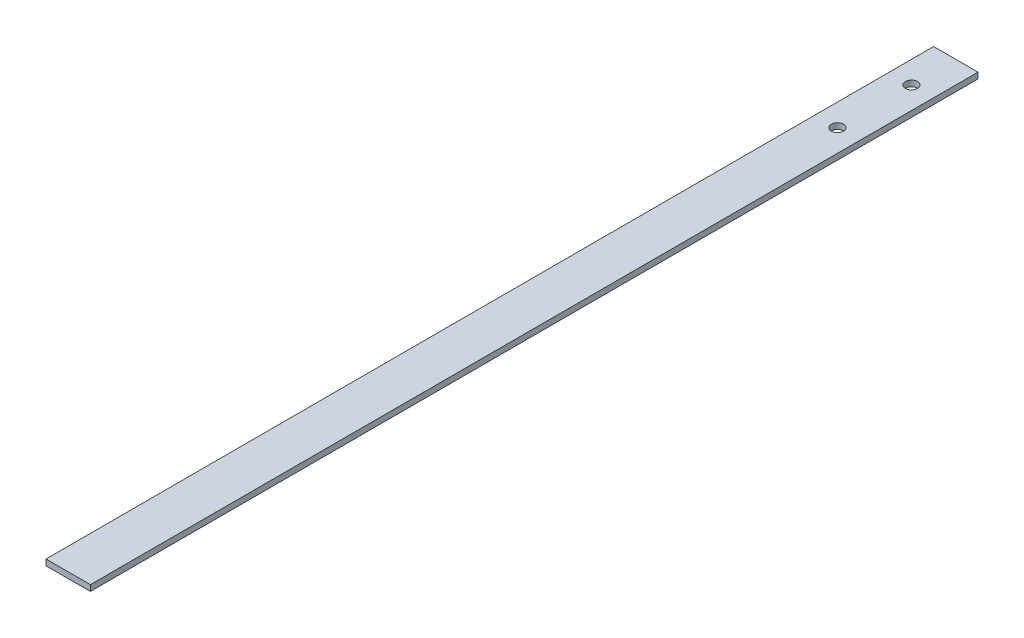
from build123d import *

# Parameters (mm, degrees)
SKETCH1_W           = 15
SKETCH1_H           = 2
BOSS_EXTRUDE1_DEPTH = 300
SKETCH2_R           = 2.05
CUT_EXTRUDE1_DEPTH  = 301.381424193


with BuildPart() as part:
    # Sketch1 → Boss-Extrude1 (new body)
    with BuildSketch(Plane.XY):
        with Locations((7.5, 1)):
            Rectangle(SKETCH1_W, SKETCH1_H)
    extrude(amount=BOSS_EXTRUDE1_DEPTH)

    # Sketch2 → Cut-Extrude1 (cut, through all)
    with BuildSketch(Plane(origin=(0, 2, 0), x_dir=(1, 0, 0), z_dir=(0, 1, 0))):
        with Locations(Location((7.5, -15, 0), (0, 0, 270))):
            Circle(SKETCH2_R)
        with Locations(Location((7.5, -40, 0), (0, 0, 270))):
            Circle(SKETCH2_R)
    extrude(amount=-CUT_EXTRUDE1_DEPTH, mode=Mode.SUBTRACT)


solid = part.part
